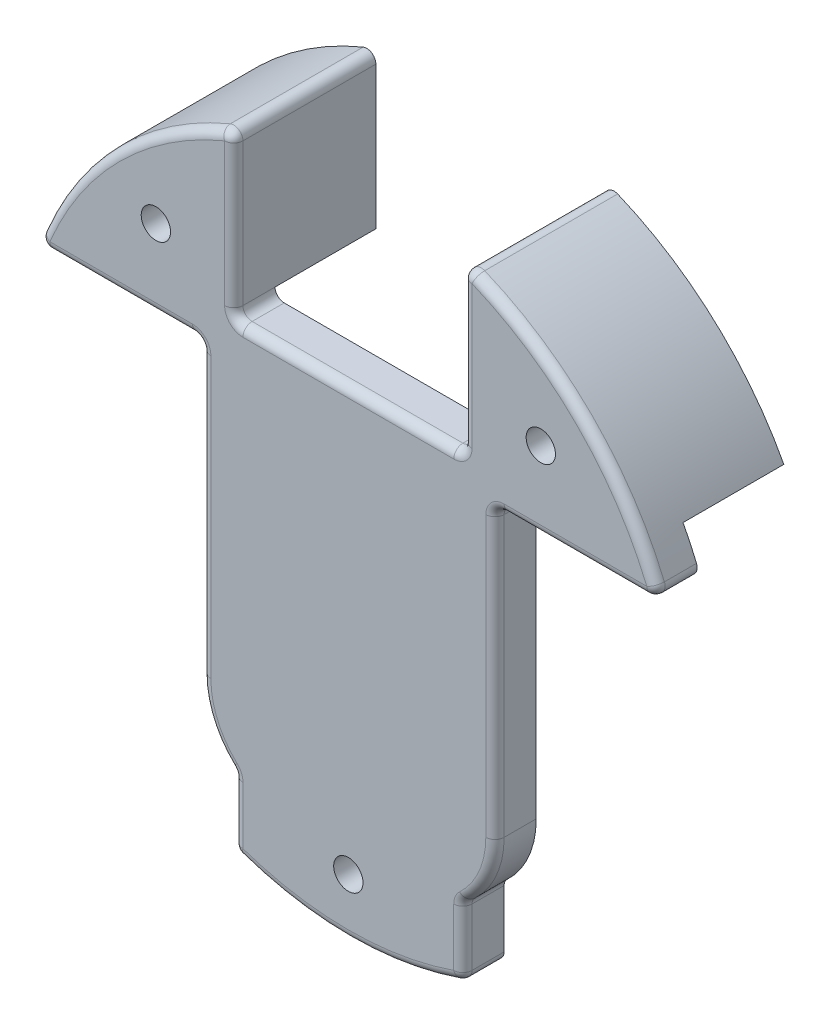
from build123d import *

# Parameters (mm, degrees)
SKETCH_1_R                = 36.25
EXTRUDE_1_DEPTH           = 10
SKETCH_2_W                = 25
SKETCH_2_H                = 20.25
CUT_EXTRUDE_1_DEPTH       = 4.5
SKETCH_3_W                = 23.75
SKETCH_3_H                = 48.75
CUT_EXTRUDE_2_DEPTH       = 4.5
SKETCH_4_R                = 10
EXTRUDE_2_DEPTH           = 4.5
SKETCH_5_R                = 10
EXTRUDE_3_DEPTH           = 4.5
SKETCH_6_W                = 32
SKETCH_6_H                = 31.5
EXTRUDE_4_DEPTH           = 4.5
SKETCH_7_R                = 36.25
CUT_EXTRUDE_3_DEPTH       = 5.5
SKETCH_8_W                = 23.75
SKETCH_8_H                = 19.25
EXTRUDE_5_DEPTH           = 11
SKETCH_9_OUTSIDE_W        = 95.24
SKETCH_9_OUTSIDE_H        = 95.24
SKETCH_9_OUTSIDE_R        = 36.25
CUT_EXTRUDE_4_DEPTH       = 11
HOLE_WIZARD_1_D           = 1.6
HOLE_WIZARD_1_DEPTH       = 100
HOLE_WIZARD_1_CBORE_D     = 3.2
HOLE_WIZARD_1_CBORE_DEPTH = 14.1
HOLE_WIZARD_2_D           = 1.6
HOLE_WIZARD_2_DEPTH       = 100
HOLE_WIZARD_2_CBORE_D     = 3.2
HOLE_WIZARD_2_CBORE_DEPTH = 3.1
FILLET_1_R                = 1
FILLET_2_R                = 1


with BuildPart() as part:
    # 草图1 → 凸台-拉伸1 (new body)
    with BuildSketch(Plane.XY):
        Circle(SKETCH_1_R)
    extrude(amount=EXTRUDE_1_DEPTH)

    # 草图2 → 切除-拉伸1 (cut)
    with BuildSketch(Plane.XY):
        with Locations((0, 26.125)):
            Rectangle(SKETCH_2_W, SKETCH_2_H)
    extrude(amount=CUT_EXTRUDE_1_DEPTH, mode=Mode.SUBTRACT)

    # 草图3 → 切除-拉伸2 (cut)
    with BuildSketch(Plane.XY):
        with Locations((-24.375, -11.875)):
            Rectangle(SKETCH_3_W, SKETCH_3_H)
        with Locations((24.375, -11.875)):
            Rectangle(SKETCH_3_W, SKETCH_3_H)
    extrude(amount=CUT_EXTRUDE_2_DEPTH, mode=Mode.SUBTRACT)

    # 草图4 → 凸台-拉伸2 (add)
    with BuildSketch(Plane.XY):
        with Locations((-6, -19)):
            Circle(SKETCH_4_R)
    extrude(amount=EXTRUDE_2_DEPTH)

    # 草图5 → 凸台-拉伸3 (add)
    with BuildSketch(Plane.XY):
        with Locations((6, -19)):
            Circle(SKETCH_5_R)
    extrude(amount=EXTRUDE_3_DEPTH)

    # 草图6 → 凸台-拉伸4 (add)
    with BuildSketch(Plane.XY):
        with Locations((0, -3.25)):
            Rectangle(SKETCH_6_W, SKETCH_6_H)
    extrude(amount=EXTRUDE_4_DEPTH)

    # 草图7 → 切除-拉伸3 (cut)
    with BuildSketch(Plane(origin=(0, 0, 4.5), x_dir=(-1, 0, 0), z_dir=(0, 0, -1))):
        Circle(SKETCH_7_R)
    extrude(amount=-CUT_EXTRUDE_3_DEPTH, mode=Mode.SUBTRACT)

    # 草图8 → 凸台-拉伸5 (add)
    with BuildSketch(Plane.XY):
        with Locations((-24.375, 26.625)):
            Rectangle(SKETCH_8_W, SKETCH_8_H)
        with Locations((24.375, 26.625)):
            Rectangle(SKETCH_8_W, SKETCH_8_H)
    extrude(amount=-EXTRUDE_5_DEPTH)

    # 草图9 outside → 切除-拉伸4 (cut)
    with BuildSketch(Plane.XY):
        Rectangle(SKETCH_9_OUTSIDE_W, SKETCH_9_OUTSIDE_H)
        Circle(SKETCH_9_OUTSIDE_R, mode=Mode.SUBTRACT)
    extrude(amount=-CUT_EXTRUDE_4_DEPTH, mode=Mode.SUBTRACT)

    # 孔1
    with Locations(Plane.XY.offset(4.5)):
        with Locations((-21, 21), (21, 21)):
            CounterBoreHole(HOLE_WIZARD_1_D / 2, HOLE_WIZARD_1_CBORE_D / 2, HOLE_WIZARD_1_CBORE_DEPTH, depth=HOLE_WIZARD_1_DEPTH)

    # 孔2
    with Locations(Plane.XY.offset(4.5)):
        with Locations((0, -30)):
            CounterBoreHole(HOLE_WIZARD_2_D / 2, HOLE_WIZARD_2_CBORE_D / 2, HOLE_WIZARD_2_CBORE_DEPTH, depth=HOLE_WIZARD_2_DEPTH)

    # 圆角1
    fillet_1_edges = [part.edges().sort_by_distance(p)[0] for p in [
        (-16, 12.5, 2.25),
        (16, 12.5, 2.25),
        (12.5, 16, 2.25),
        (-12.5, 34.026643972, -3.25),
        (-12.5, 16, 2.25),
        (12.5, 34.026643972, -3.25),
        (-12.5, -34.026643972, 2.25),
        (-34.026643972, 12.5, 2.25),
        (12.5, -34.026643972, 2.25),
        (34.026643972, 12.5, 2.25),
        (-12.5, -26.599342077, 2.25),
        (12.5, -26.599342077, 2.25),
    ]]
    fillet(fillet_1_edges, radius=FILLET_1_R)

    # 圆角2
    fillet_2_edges = [part.edges().sort_by_distance(p)[0] for p in [
        (-16.292893219, 12.207106781, 4.5),
        (-24.78122001, 12.5, 4.5),
        (-33.393998413, 12.94456266, 4.5),
        (0, -36.25, 4.5),
        (-12.94456266, 33.393998413, 4.5),
        (-12.5, 24.78122001, 4.5),
        (-12.207106781, 16.292893219, 4.5),
        (0, 16, 4.5),
        (12.207106781, 16.292893219, 4.5),
        (12.5, 24.78122001, 4.5),
        (12.94456266, 33.393998413, 4.5),
        (33.393998413, 12.94456266, 4.5),
        (24.78122001, 12.5, 4.5),
        (16.292893219, 12.207106781, 4.5),
        (16, -3.75, 4.5),
        (15.170109546, -22.988620176, 4.5),
        (12.582989045, -26.647876452, 4.5),
        (12.5, -30.184045242, 4.5),
        (12.314322152, -33.90176517, 4.5),
        (-12.314322152, -33.90176517, 4.5),
        (-12.5, -30.184045242, 4.5),
        (-12.582989045, -26.647876452, 4.5),
        (-15.170109546, -22.988620176, 4.5),
        (-16, -3.75, 4.5),
    ]]
    fillet(fillet_2_edges, radius=FILLET_2_R)


solid = part.part
